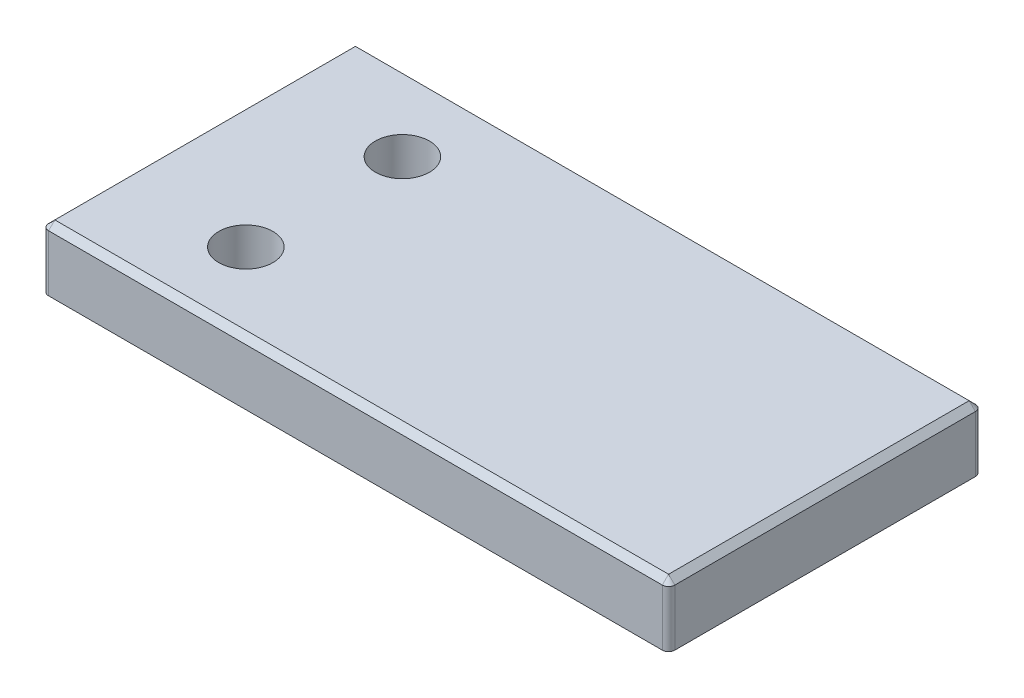
from build123d import *

# Parameters (mm, degrees)
SKETCH_1_W          = 100
SKETCH_1_H          = 50
EXTRUDE_1_DEPTH     = 10
FILLET_1_R          = 1
CHAMFER_2_SIZE      = 1
HOLE_WIZARD_1_D     = 8.647
HOLE_WIZARD_1_DEPTH = 26.2
HOLE_WIZARD_1_TIP   = 2.597820886


with BuildPart() as part:
    # 草圖1 → 擠出1 (new body)
    with BuildSketch(Plane(origin=(0, 0, 0), x_dir=(-1, 0, 0), z_dir=(0, 1, 0))):
        Rectangle(SKETCH_1_W, SKETCH_1_H)
    extrude(amount=EXTRUDE_1_DEPTH)

    # 圓角1
    fillet_1_edges = [part.edges().sort_by_distance(p)[0] for p in [
        (-50, 5, -25),
        (50, 5, -25),
        (50, 5, 25),
        (-50, 5, 25),
    ]]
    fillet(fillet_1_edges, radius=FILLET_1_R)

    # 倒角2
    chamfer_2_edges = [part.edges().sort_by_distance(p)[0] for p in [
        (0, 10, 25),
        (-50, 10, 0),
        (50, 10, 0),
        (0, 10, -25),
        (49.707106781, 10, 24.707106781),
        (49.707106781, 10, -24.707106781),
        (-49.707106781, 10, -24.707106781),
        (-49.707106781, 10, 24.707106781),
    ]]
    chamfer(chamfer_2_edges, length=CHAMFER_2_SIZE)

    # 孔1
    with Locations(Plane(origin=(0, 10, 0), x_dir=(1, 0, 0), z_dir=(0, 1, 0))):
        with Locations((-30, 12.5), (-30, -12.5)):
            Hole(HOLE_WIZARD_1_D / 2, depth=HOLE_WIZARD_1_DEPTH)
            with Locations((0, 0, -(HOLE_WIZARD_1_DEPTH + HOLE_WIZARD_1_TIP / 2))):  # 118° drill point
                Cone(0, HOLE_WIZARD_1_D / 2, HOLE_WIZARD_1_TIP, mode=Mode.SUBTRACT)


solid = part.part
